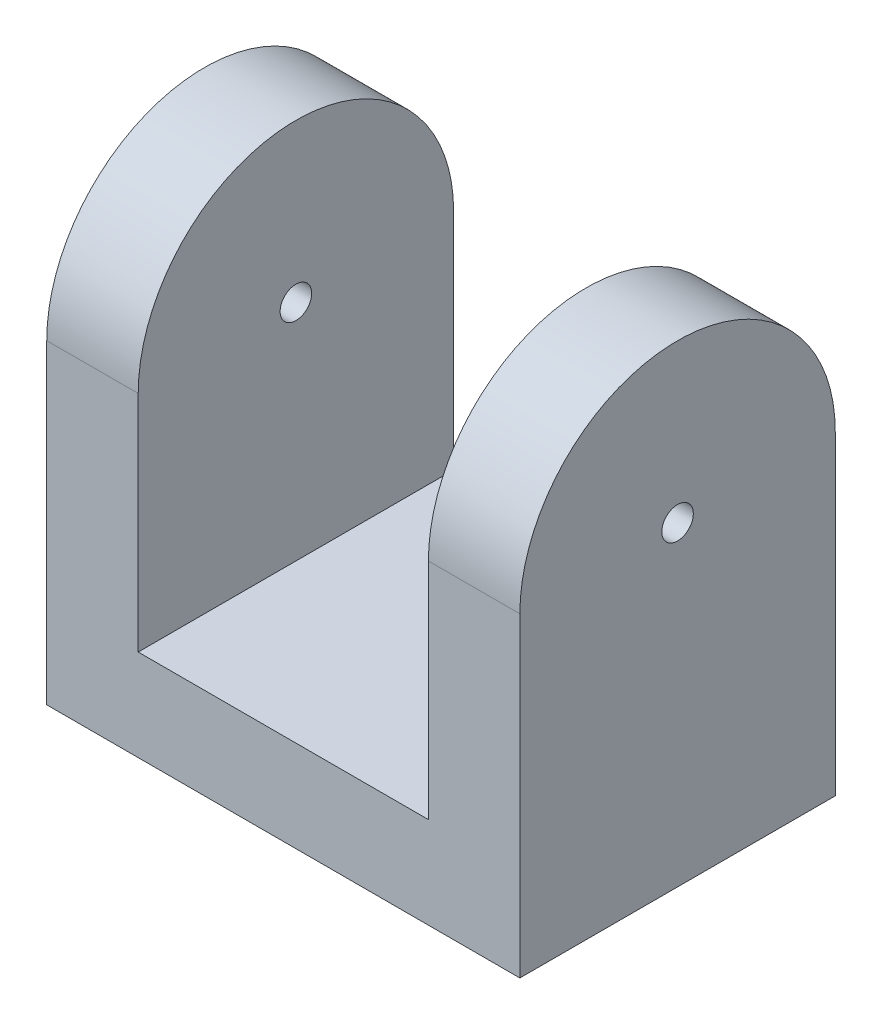
from build123d import *

# Parameters (mm, degrees)
SKIZZE1_R                       = 50
SKIZZE1_R_2                     = 5
AUFSATZ_LINEAR_AUSTRAGEN1_DEPTH = 150
SKIZZE2_W                       = 92
SKIZZE2_H                       = 50
SKIZZE2_H_2                     = 71
SCHNITT_LINEAR_AUSTRAGEN1_DEPTH = 207.155281281


with BuildPart() as part:
    # Skizze1 → Aufsatz-Linear austragen1 (new body)
    # profile 1 of 2: a face of its own
    with BuildSketch(Plane(origin=(0, 0, 0), x_dir=(0, 0, -1), z_dir=(1, 0, 0))):
        Circle(SKIZZE1_R)
        Circle(SKIZZE1_R_2, mode=Mode.SUBTRACT)
    # profile 2 of 2: a face of its own
    with BuildSketch(Plane(origin=(0, 0, 0), x_dir=(0, 0, -1), z_dir=(1, 0, 0))):
        with BuildLine():
            ThreePointArc((50, 0), (0, -50), (-50, 0))
            Line((-50, 0), (-50, -100))
            Line((-50, -100), (50, -100))
            Line((50, -100), (50, 0))
        make_face()
    extrude(amount=AUFSATZ_LINEAR_AUSTRAGEN1_DEPTH)

    # Skizze2 → Schnitt-Linear austragen1 (cut, through all)
    with BuildSketch(Plane.XY.offset(50)):
        with Locations((75, 25)):
            Rectangle(SKIZZE2_W, SKIZZE2_H)
        with Locations((75, -35.5)):
            Rectangle(SKIZZE2_W, SKIZZE2_H_2)
    extrude(amount=-SCHNITT_LINEAR_AUSTRAGEN1_DEPTH, mode=Mode.SUBTRACT)


solid = part.part
